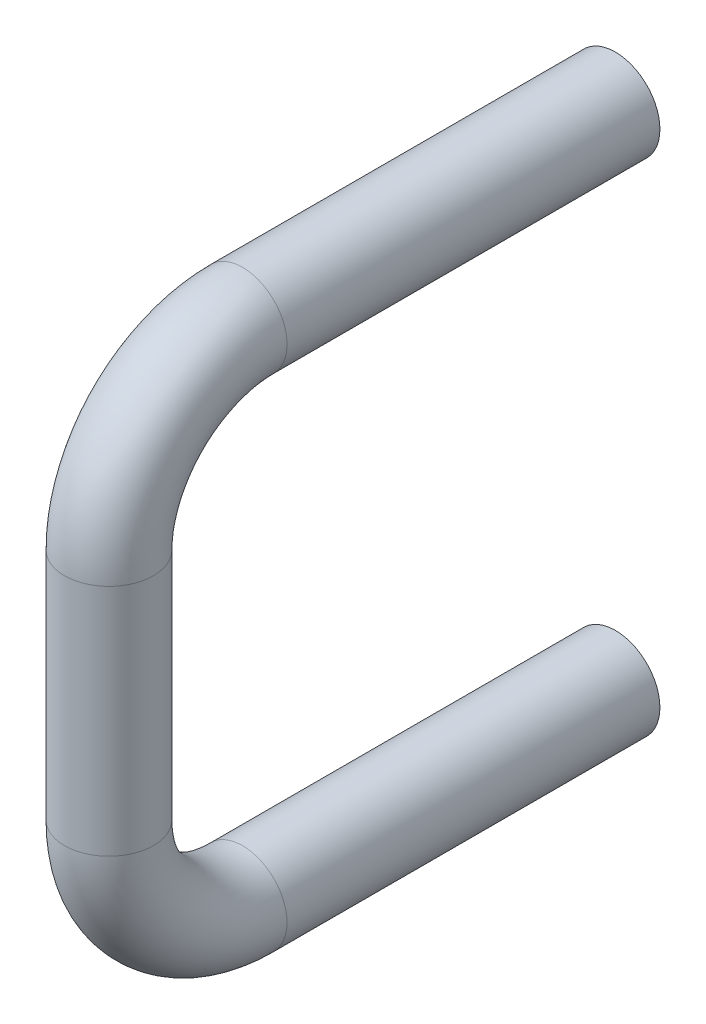
from build123d import *

# Parameters (mm, degrees)
PIPE_1_PROFILE_R = 8


with BuildPart() as part:
    # Pipe 1: sweep along a curve in space
    with BuildLine() as pipe_1_path:
        Line((240, -45, 323), (240, -45, 390))
        ThreePointArc((240, -45, 390), (240, -37.970562748, 406.970562748), (240, -21, 414))
        Line((240, -21, 414), (240, 21, 414))
        ThreePointArc((240, 21, 414), (240, 37.970562748, 406.970562748), (240, 45, 390))
        Line((240, 45, 390), (240, 45, 323))
    # Pipe 1 profile (on start of the path) → Pipe 1 (sweep)
    with BuildSketch(Plane(origin=(240, -45, 323), x_dir=(1, 0, 0), z_dir=(0, 0, 1))):
        Circle(PIPE_1_PROFILE_R)
    sweep(path=pipe_1_path.line)


solid = part.part
